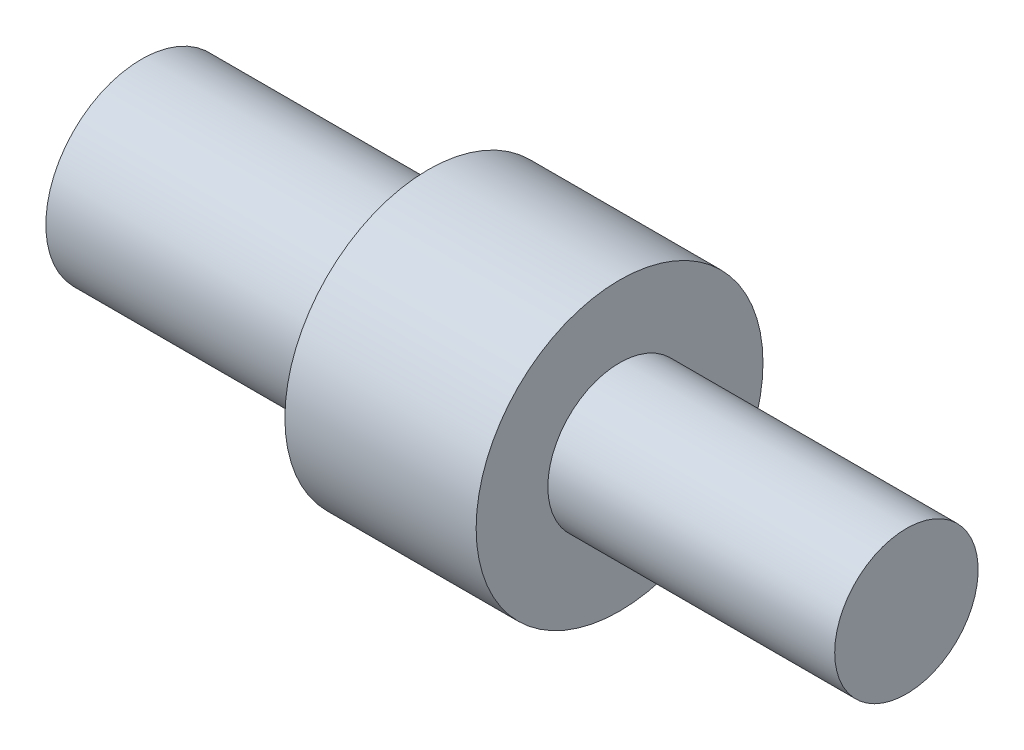
from build123d import *

# Parameters (mm, degrees)
SKETCH1_R           = 9.525
BOSS_EXTRUDE1_DEPTH = 6.35
SKETCH2_R           = 4.7625
BOSS_EXTRUDE2_DEPTH = 19.05
SKETCH3_R           = 6.35
BOSS_EXTRUDE3_DEPTH = 19.05


with BuildPart() as part:
    # Sketch1 → Boss-Extrude1 (new, symmetric)
    with BuildSketch(Plane(origin=(0, 0, 0), x_dir=(0, 0, -1), z_dir=(1, 0, 0))):
        Circle(SKETCH1_R)
    extrude(amount=BOSS_EXTRUDE1_DEPTH, both=True)

    # Sketch2 → Boss-Extrude2 (add)
    with BuildSketch(Plane(origin=(6.35, 0, 0), x_dir=(0, 0, -1), z_dir=(1, 0, 0))):
        with Locations(Location((0, 0, 0), (0, 0, 180))):
            Circle(SKETCH2_R)
    extrude(amount=BOSS_EXTRUDE2_DEPTH)

    # Sketch3 → Boss-Extrude3 (add)
    with BuildSketch(Plane.ZY.offset(6.35)):
        with Locations(Location((0, 0, 0), (0, 0, 180))):
            Circle(SKETCH3_R)
    extrude(amount=BOSS_EXTRUDE3_DEPTH)


solid = part.part
